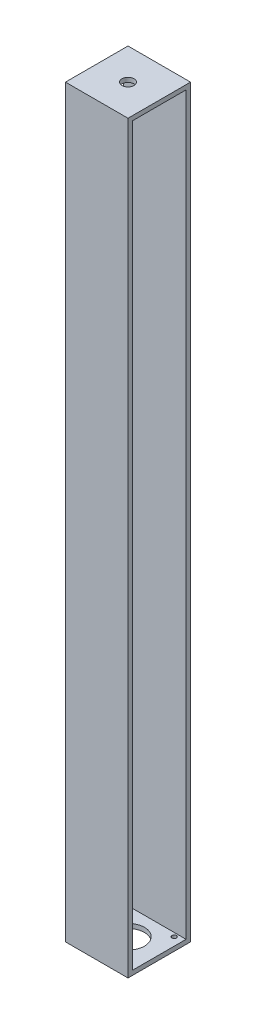
from build123d import *

# Parameters (mm, degrees)
SKETCH_1_W          = 42
SKETCH_1_H          = 42
EXTRUDE_1_DEPTH     = 500
SKETCH_2_R          = 11
SKETCH_2_R_2        = 1.5
CUT_EXTRUDE_1_DEPTH = 3
SKETCH_3_R          = 4
CUT_EXTRUDE_2_DEPTH = 3
SKETCH_4_W          = 36
SKETCH_4_H          = 494
CUT_EXTRUDE_3_DEPTH = 504.515640273


with BuildPart() as part:
    # 草图1 → 凸台-拉伸1 (new body)
    with BuildSketch(Plane(origin=(0, 0, 0), x_dir=(1, 0, 0), z_dir=(0, 1, 0))):
        with Locations((21, -21)):
            Rectangle(SKETCH_1_W, SKETCH_1_H)
    extrude(amount=EXTRUDE_1_DEPTH)

    # 草图2 → 切除-拉伸1 (cut)
    with BuildSketch(Plane.XZ):
        with Locations(Location((21, 21, 0), (0, 0, 270))):
            Circle(SKETCH_2_R)
        with Locations(Location((5.5, 5.5, 0), (0, 0, 270))):
            Circle(SKETCH_2_R_2)
        with Locations(Location((5.5, 36.5, 0), (0, 0, 90))):
            Circle(SKETCH_2_R_2)
        with Locations(Location((36.5, 5.5, 0), (0, 0, 90))):
            Circle(SKETCH_2_R_2)
        with Locations(Location((36.5, 36.5, 0), (0, 0, 270))):
            Circle(SKETCH_2_R_2)
    extrude(amount=-CUT_EXTRUDE_1_DEPTH, mode=Mode.SUBTRACT)

    # 草图3 → 切除-拉伸2 (cut)
    with BuildSketch(Plane(origin=(0, 500, 0), x_dir=(1, 0, 0), z_dir=(0, 1, 0))):
        with Locations(Location((21, -21, 0), (0, 0, 270))):
            Circle(SKETCH_3_R)
    extrude(amount=-CUT_EXTRUDE_2_DEPTH, mode=Mode.SUBTRACT)

    # 草图4 → 切除-拉伸3 (cut, through all)
    with BuildSketch(Plane(origin=(0, 0, 0), x_dir=(0, 0, -1), z_dir=(1, 0, 0))):
        with Locations((-21, 250)):
            Rectangle(SKETCH_4_W, SKETCH_4_H)
    extrude(amount=CUT_EXTRUDE_3_DEPTH, mode=Mode.SUBTRACT)


solid = part.part
